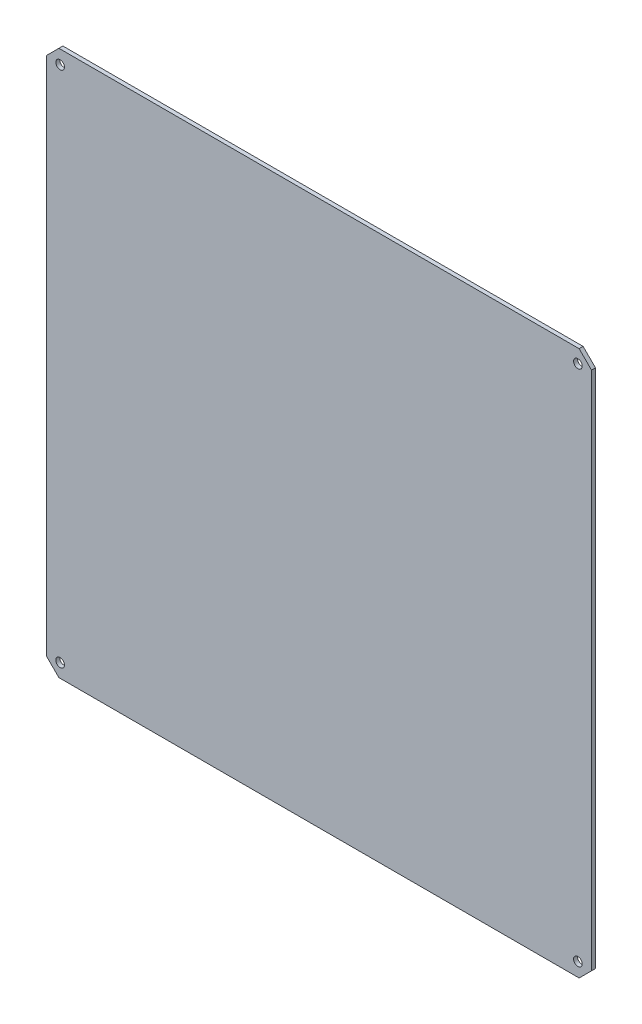
from build123d import *

# Parameters (mm, degrees)
SZKIC1_W                    = 220
SZKIC1_H                    = 220
SZKIC1_R                    = 1.75
DODANIE_WYCI_GNI_CIE1_DEPTH = 1.6
SFAZOWANIE1_SIZE            = 5


with BuildPart() as part:
    # Szkic1 → Dodanie-wyciągnięcie1 (new body)
    with BuildSketch(Plane.XY):
        Rectangle(SZKIC1_W, SZKIC1_H)
        with Locations((104.5, 104.5)):
            Circle(SZKIC1_R, mode=Mode.SUBTRACT)
        with Locations((-104.5, 104.5)):
            Circle(SZKIC1_R, mode=Mode.SUBTRACT)
        with Locations((-104.5, -104.5)):
            Circle(SZKIC1_R, mode=Mode.SUBTRACT)
        with Locations((104.5, -104.5)):
            Circle(SZKIC1_R, mode=Mode.SUBTRACT)
    extrude(amount=DODANIE_WYCI_GNI_CIE1_DEPTH)

    # Sfazowanie1
    sfazowanie1_edges = [part.edges().sort_by_distance(p)[0] for p in [
        (110, -110, 0.8),
        (-110, -110, 0.8),
        (-110, 110, 0.8),
        (110, 110, 0.8),
    ]]
    chamfer(sfazowanie1_edges, length=SFAZOWANIE1_SIZE)


solid = part.part
